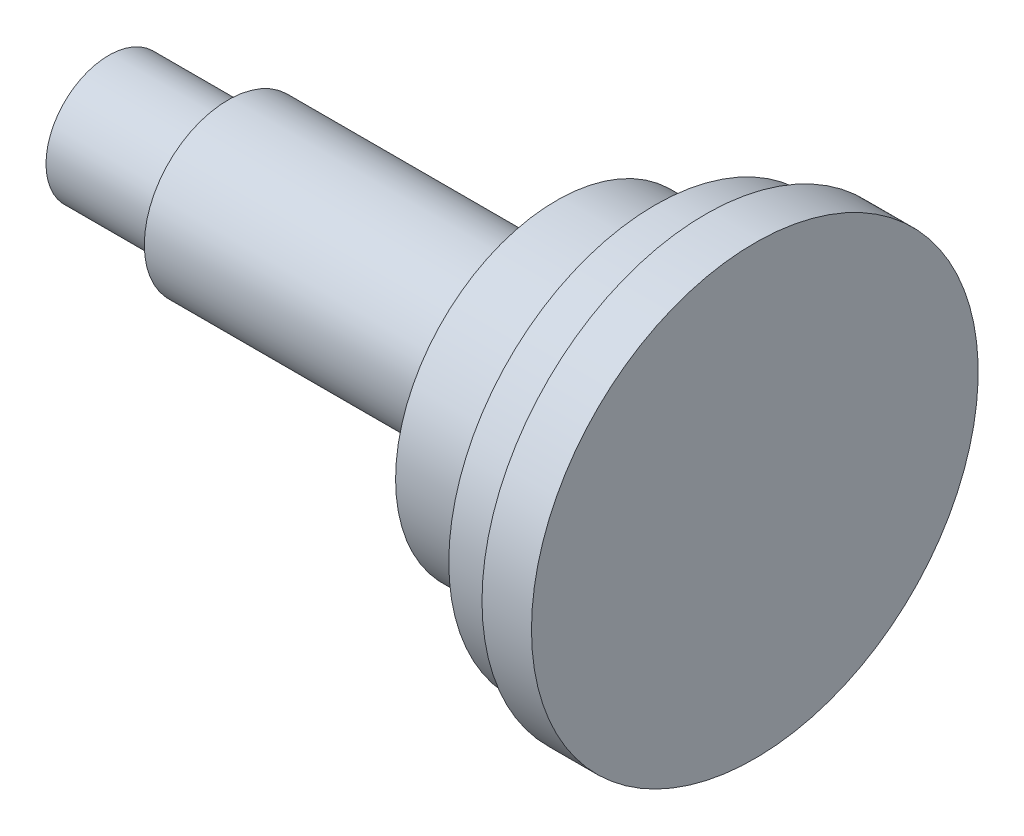
from build123d import *


with BuildPart() as part:
    # Sketch1 → Revolve1 (revolve)
    with BuildSketch(Plane.XY, mode=Mode.PRIVATE) as revolve1_sk:
        Polygon((-64.510967422, 0), (-64.510967422, 9.55), (-46.34574906, 9.55), (-46.34574906, 12.75), (3.65425094, 12.75), (3.65425094, 24.5), (18.65425094, 24.5), (18.65425094, 31.4), (26.309592964, 31.4), (26.309592964, 34), (33.840714853, 34), (33.840714853, 0), align=None)
    revolve(revolve1_sk.sketch.rotate(Axis((-64.510967422, 0, 0), (1, 0, 0)), 90), axis=Axis((-64.510967422, 0, 0), (1, 0, 0)))


solid = part.part
